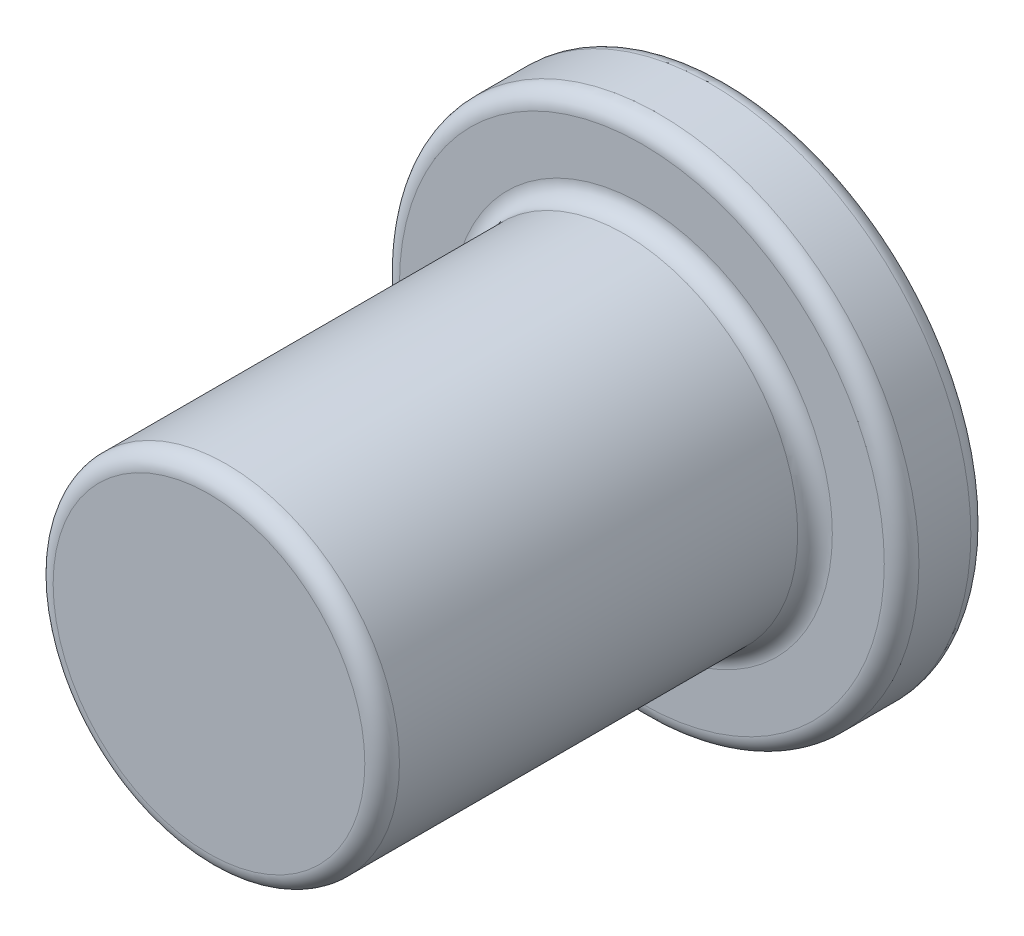
from build123d import *

# Parameters (mm, degrees)
SKETCH1_R           = 3
BOSS_EXTRUDE1_DEPTH = 0.5
SKETCH2_R           = 2
BOSS_EXTRUDE2_DEPTH = 5
FILLET1_R           = 0.2


with BuildPart() as part:
    # Sketch1 → Boss-Extrude1 (new, symmetric)
    with BuildSketch(Plane.XY):
        Circle(SKETCH1_R)
    extrude(amount=BOSS_EXTRUDE1_DEPTH, both=True)

    # Sketch2 → Boss-Extrude2 (add)
    with BuildSketch(Plane.XY.offset(0.5)):
        Circle(SKETCH2_R)
    extrude(amount=BOSS_EXTRUDE2_DEPTH)

    # Fillet1
    fillet1_edges = [part.edges().sort_by_distance(p)[0] for p in [
        (-3, 0, -0.5),
        (-3, 0, 0.5),
        (-2, 0, 0.5),
        (-2, 0, 5.5),
    ]]
    fillet(fillet1_edges, radius=FILLET1_R)


solid = part.part
